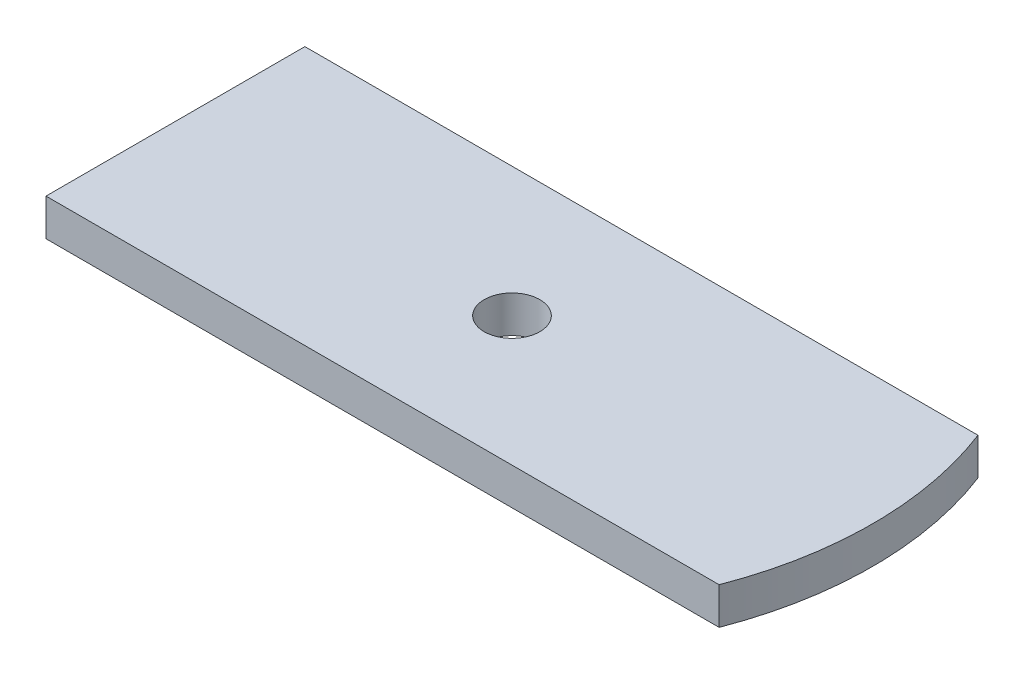
from build123d import *

# Parameters (mm, degrees)
AUFSATZ_LINEAR_AUSTRAGEN1_DEPTH = 20


with BuildPart() as part:
    # Skizze1 → Aufsatz-Linear austragen1 (new body)
    with BuildSketch(Plane(origin=(0, 0, 0), x_dir=(1, 0, 0), z_dir=(0, 1, 0))):
        with BuildLine():
            Line((182.002747232, 70), (-182.002747232, 70))
            Line((-182.002747232, 70), (-182.002747232, -70))
            Line((-182.002747232, -70), (182.002747232, -70))
            ThreePointArc((182.002747232, -70), (195, 0), (182.002747232, 70))
        make_face()
        with BuildLine():
            ThreePointArc((15.05, 0), (-10.641957057, 10.641957057), (0, -15.05))
            ThreePointArc((0, -15.05), (10.641957057, -10.641957057), (15.05, 0))
        make_face(mode=Mode.SUBTRACT)
    extrude(amount=AUFSATZ_LINEAR_AUSTRAGEN1_DEPTH)


solid = part.part
